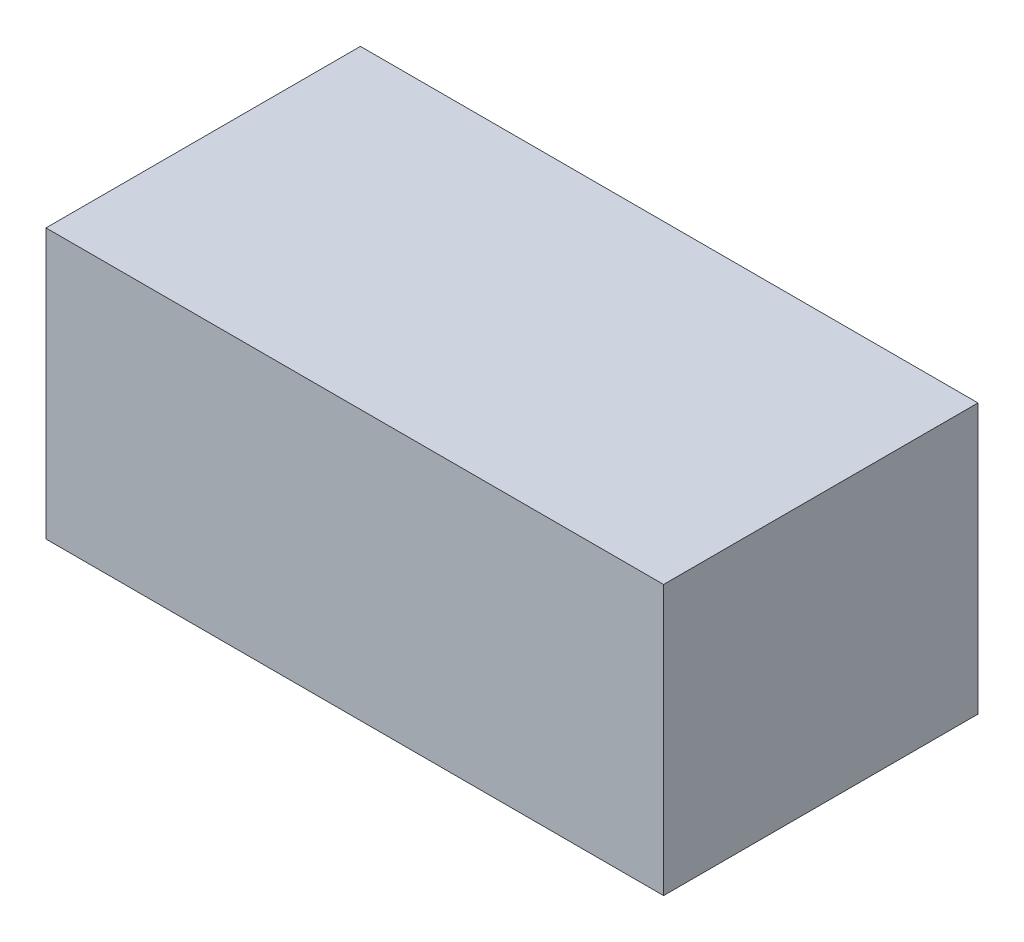
from build123d import *

# Parameters (mm, degrees)
SKETCH_1_W      = 55
SKETCH_1_H      = 28
EXTRUDE_1_DEPTH = 24


with BuildPart() as part:
    # 草图1 → 凸台-拉伸1 (new body)
    with BuildSketch(Plane(origin=(0, 0, 0), x_dir=(1, 0, 0), z_dir=(0, 1, 0))):
        Rectangle(SKETCH_1_W, SKETCH_1_H)
    extrude(amount=EXTRUDE_1_DEPTH)


solid = part.part
